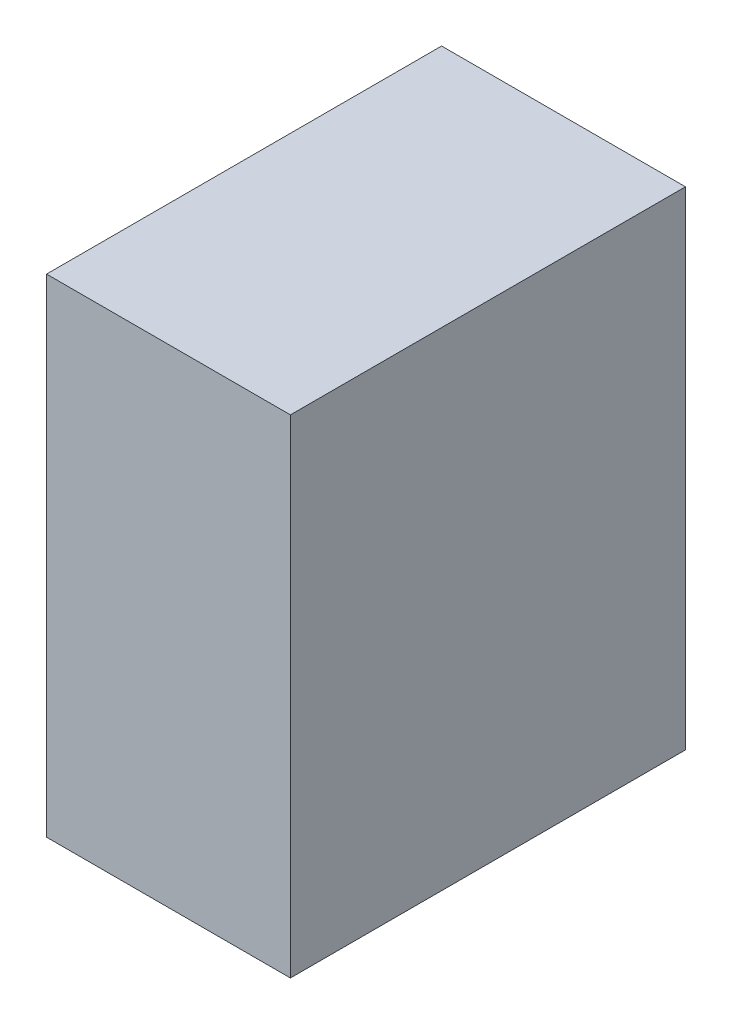
from build123d import *

# Parameters (mm, degrees)
SKETCH1_W           = 16.2
SKETCH1_H           = 20
BOSS_EXTRUDE1_DEPTH = 10


with BuildPart() as part:
    # Sketch1 → Boss-Extrude1 (new body)
    with BuildSketch(Plane(origin=(0, 0, 0), x_dir=(0, 0, -1), z_dir=(1, 0, 0))):
        with Locations((8.1, 10)):
            Rectangle(SKETCH1_W, SKETCH1_H)
    extrude(amount=BOSS_EXTRUDE1_DEPTH)


solid = part.part
